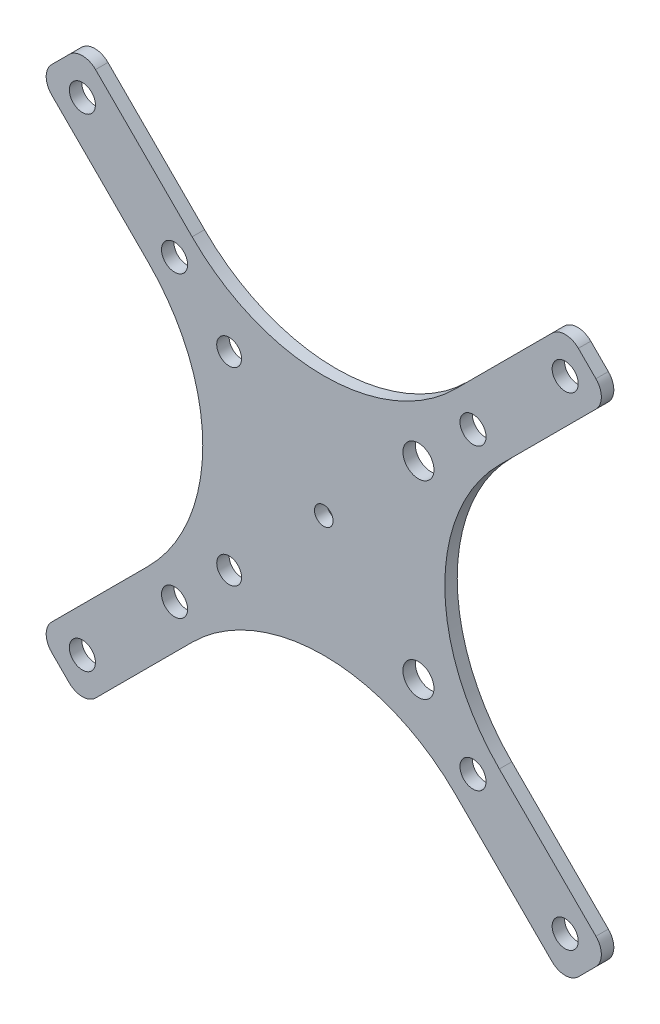
from build123d import *

# Parameters (mm, degrees)
CROQUIS1_R              = 2
CROQUIS1_R_2            = 2.1
CROQUIS1_R_3            = 2.5
CROQUIS1_R_4            = 1.5
SALIENTE_EXTRUIR1_DEPTH = 2
REDONDEO3_R             = 3


with BuildPart() as part:
    # Croquis1 → Saliente-Extruir1 (new body)
    with BuildSketch(Plane.XY):
        with BuildLine():
            Line((-31.096194078, 38.16726189), (-21.213203436, 28.284271247))
            ThreePointArc((-21.213203436, 28.284271247), (0, 19.497474683), (21.213203436, 28.284271247))
            Line((21.213203436, 28.284271247), (31.096194078, 38.16726189))
            Line((31.096194078, 38.16726189), (38.890872965, 45.961940777))
            Line((38.890872965, 45.961940777), (42.426406871, 42.426406871))
            Line((42.426406871, 42.426406871), (45.961940777, 38.890872965))
            Line((45.961940777, 38.890872965), (38.16726189, 31.096194078))
            Line((38.16726189, 31.096194078), (28.284271247, 21.213203436))
            ThreePointArc((28.284271247, 21.213203436), (19.497474683, 0), (28.284271247, -21.213203436))
            Line((28.284271247, -21.213203436), (38.16726189, -31.096194078))
            Line((38.16726189, -31.096194078), (45.961940777, -38.890872965))
            Line((45.961940777, -38.890872965), (42.426406871, -42.426406871))
            Line((42.426406871, -42.426406871), (38.890872965, -45.961940777))
            Line((38.890872965, -45.961940777), (31.096194078, -38.16726189))
            Line((31.096194078, -38.16726189), (21.213203436, -28.284271247))
            ThreePointArc((21.213203436, -28.284271247), (0, -19.497474683), (-21.213203436, -28.284271247))
            Line((-21.213203436, -28.284271247), (-31.096194078, -38.16726189))
            Line((-31.096194078, -38.16726189), (-38.890872965, -45.961940777))
            Line((-38.890872965, -45.961940777), (-42.426406871, -42.426406871))
            Line((-42.426406871, -42.426406871), (-45.961940777, -38.890872965))
            Line((-45.961940777, -38.890872965), (-38.16726189, -31.096194078))
            Line((-38.16726189, -31.096194078), (-28.284271247, -21.213203436))
            ThreePointArc((-28.284271247, -21.213203436), (-19.497474683, 0), (-28.284271247, 21.213203436))
            Line((-28.284271247, 21.213203436), (-38.16726189, 31.096194078))
            Line((-38.16726189, 31.096194078), (-45.961940777, 38.890872965))
            Line((-45.961940777, 38.890872965), (-42.426406871, 42.426406871))
            Line((-42.426406871, 42.426406871), (-38.890872965, 45.961940777))
            Line((-38.890872965, 45.961940777), (-31.096194078, 38.16726189))
        make_face()
        with Locations((-15.25, 15.25)):
            Circle(CROQUIS1_R, mode=Mode.SUBTRACT)
        with Locations((-24.04163056, 24.04163056)):
            Circle(CROQUIS1_R_2, mode=Mode.SUBTRACT)
        with Locations((-38.890872965, 38.890872965)):
            Circle(CROQUIS1_R_2, mode=Mode.SUBTRACT)
        with Locations(Location((38.890872965, 38.890872965, 0), (0, 0, 180))):
            Circle(CROQUIS1_R_2, mode=Mode.SUBTRACT)
        with Locations(Location((24.04163056, 24.04163056, 0), (0, 0, 180))):
            Circle(CROQUIS1_R_2, mode=Mode.SUBTRACT)
        with Locations(Location((15.25, 15.25, 0), (0, 0, 180))):
            Circle(CROQUIS1_R_3, mode=Mode.SUBTRACT)
        with Locations((15.25, -15.25)):
            Circle(CROQUIS1_R_3, mode=Mode.SUBTRACT)
        with Locations((24.04163056, -24.04163056)):
            Circle(CROQUIS1_R_2, mode=Mode.SUBTRACT)
        with Locations((38.890872965, -38.890872965)):
            Circle(CROQUIS1_R_2, mode=Mode.SUBTRACT)
        with Locations(Location((-15.25, -15.25, 0), (0, 0, 180))):
            Circle(CROQUIS1_R, mode=Mode.SUBTRACT)
        with Locations(Location((-24.04163056, -24.04163056, 0), (0, 0, 180))):
            Circle(CROQUIS1_R_2, mode=Mode.SUBTRACT)
        with Locations(Location((-38.890872965, -38.890872965, 0), (0, 0, 180))):
            Circle(CROQUIS1_R_2, mode=Mode.SUBTRACT)
        Circle(CROQUIS1_R_4, mode=Mode.SUBTRACT)
    extrude(amount=SALIENTE_EXTRUIR1_DEPTH)

    # Redondeo3
    redondeo3_edges = [part.edges().sort_by_distance(p)[0] for p in [
        (-38.890872965, 45.961940777, 1),
        (38.890872965, 45.961940777, 1),
        (45.961940777, 38.890872965, 1),
        (45.961940777, -38.890872965, 1),
        (38.890872965, -45.961940777, 1),
        (-38.890872965, -45.961940777, 1),
        (-45.961940777, -38.890872965, 1),
        (-45.961940777, 38.890872965, 1),
    ]]
    fillet(redondeo3_edges, radius=REDONDEO3_R)


solid = part.part
